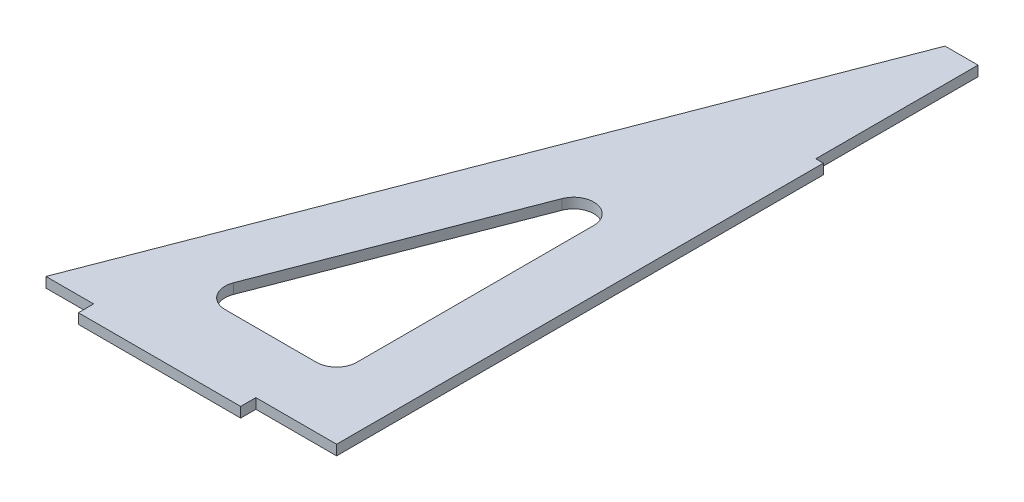
from build123d import *

# Parameters (mm, degrees)
BOSS_EXTRUDE1_DEPTH = 3.175
CUT_EXTRUDE2_DEPTH  = 3.175
FILLET2_R           = 6.35
SKETCH5_W           = 50.8
SKETCH5_H           = 3.175
BOSS_EXTRUDE2_DEPTH = 4.7625
SKETCH6_W           = 2.38125
SKETCH6_H           = 50.8
CUT_EXTRUDE3_DEPTH  = 223.661605403


with BuildPart() as part:
    # Sketch2 → Boss-Extrude1 (new body)
    with BuildSketch(Plane(origin=(0, 0, 0), x_dir=(1, 0, 0), z_dir=(0, 1, 0))):
        Polygon((0, 0), (-90.9828, 0), (-12.7, 203.2), (0, 203.2), align=None)
    extrude(amount=BOSS_EXTRUDE1_DEPTH)

    # Sketch3 → Cut-Extrude2 (cut)
    with BuildSketch(Plane(origin=(0, 3.175, 0), x_dir=(1, 0, 0), z_dir=(0, 1, 0))):
        Polygon((-19.05, 19.05), (-19.05, 133.726180748), (-63.228998633, 19.05), align=None)
    extrude(amount=-CUT_EXTRUDE2_DEPTH, mode=Mode.SUBTRACT)

    # Fillet2
    fillet2_edges = [part.edges().sort_by_distance(p)[0] for p in [
        (-19.05, 1.5875, -19.05),
        (-63.228998633, 1.5875, -19.05),
        (-19.05, 1.5875, -133.726180748),
    ]]
    fillet(fillet2_edges, radius=FILLET2_R)

    # Sketch5 → Boss-Extrude2 (add)
    with BuildSketch(Plane.XY):
        with Locations((-50.673, 1.5875)):
            Rectangle(SKETCH5_W, SKETCH5_H)
    extrude(amount=BOSS_EXTRUDE2_DEPTH)

    # Sketch6 → Cut-Extrude3 (cut, through all)
    with BuildSketch(Plane(origin=(0, 3.175, 0), x_dir=(1, 0, 0), z_dir=(0, 1, 0))):
        with Locations((-1.190625, 177.8)):
            Rectangle(SKETCH6_W, SKETCH6_H)
    extrude(amount=-CUT_EXTRUDE3_DEPTH, mode=Mode.SUBTRACT)


solid = part.part
